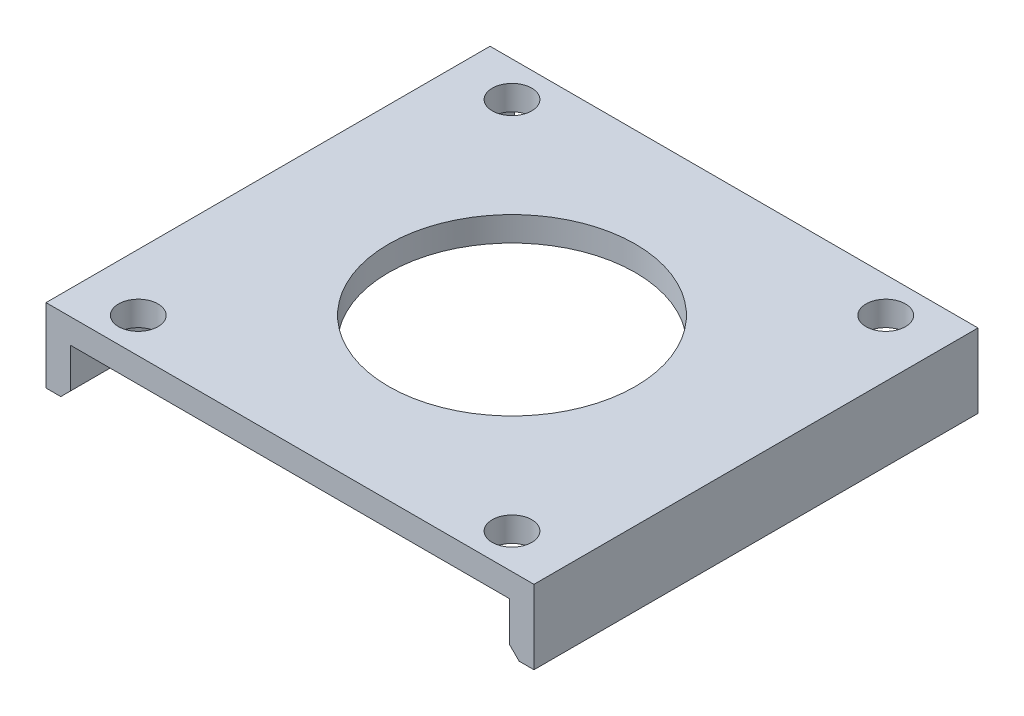
from build123d import *

# Parameters (mm, degrees)
SKETCH1_W           = 98.9
SKETCH1_H           = 90
SKETCH1_R           = 4
SKETCH1_R_2         = 25
BOSS_EXTRUDE1_DEPTH = 5
SKETCH2_W           = 5
SKETCH2_H           = 90
BOSS_EXTRUDE2_DEPTH = 10
CHAMFER1_SIZE       = 2


with BuildPart() as part:
    # Sketch1 → Boss-Extrude1 (new body)
    with BuildSketch(Plane(origin=(0, 0, 0), x_dir=(1, 0, 0), z_dir=(0, 1, 0))):
        Rectangle(SKETCH1_W, SKETCH1_H)
        with Locations(Location((37.875, -37.875, 0), (0, 0, 270))):
            Circle(SKETCH1_R, mode=Mode.SUBTRACT)
        with Locations(Location((-37.875, -37.875, 0), (0, 0, 270))):
            Circle(SKETCH1_R, mode=Mode.SUBTRACT)
        with Locations(Location((37.875, 37.875, 0), (0, 0, 270))):
            Circle(SKETCH1_R, mode=Mode.SUBTRACT)
        with Locations(Location((-37.875, 37.875, 0), (0, 0, 270))):
            Circle(SKETCH1_R, mode=Mode.SUBTRACT)
        with Locations(Location((0, 0, 0), (0, 0, 270))):
            Circle(SKETCH1_R_2, mode=Mode.SUBTRACT)
    extrude(amount=BOSS_EXTRUDE1_DEPTH)

    # Sketch2 → Boss-Extrude2 (add)
    with BuildSketch(Plane.XZ):
        with Locations((-46.95, 0)):
            Rectangle(SKETCH2_W, SKETCH2_H)
        with Locations((46.95, 0)):
            Rectangle(SKETCH2_W, SKETCH2_H)
    extrude(amount=BOSS_EXTRUDE2_DEPTH)

    # Chamfer1
    chamfer1_edges = [part.edges().sort_by_distance(p)[0] for p in [
        (-44.45, -10, 0),
        (44.45, -10, 0),
    ]]
    chamfer(chamfer1_edges, length=CHAMFER1_SIZE)


solid = part.part
